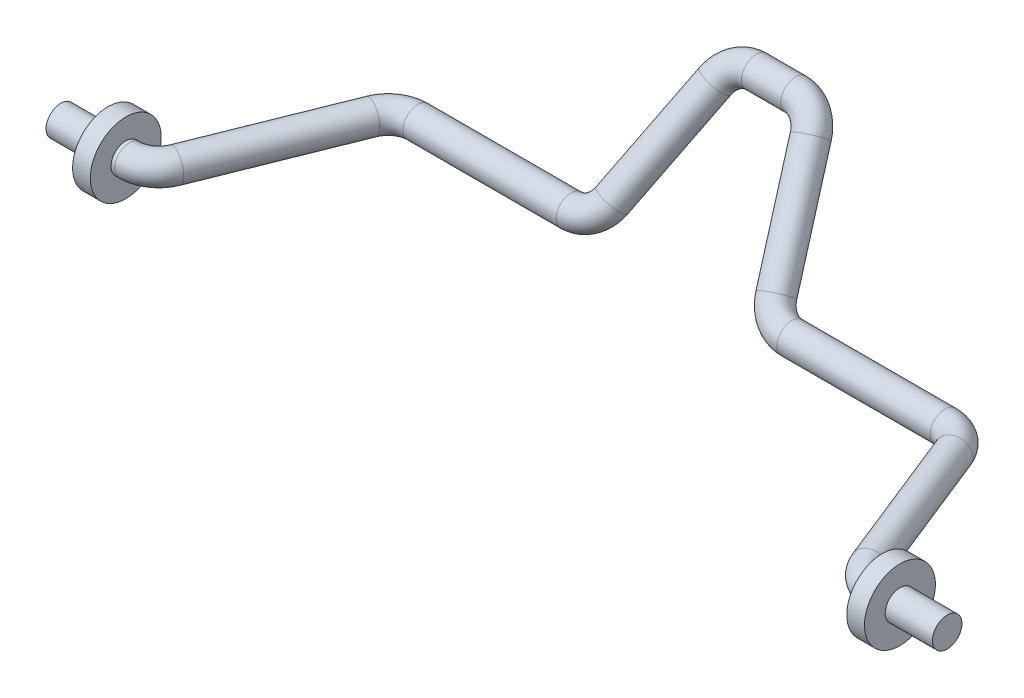
from build123d import *

# Parameters (mm, degrees)
SKETCH1_R           = 2.5
SKETCH3_R           = 6
BOSS_EXTRUDE1_DEPTH = 3


with BuildPart() as part:
    # Sweep1: sweep along a curve in space
    with BuildLine() as sweep1_path:
        Line((0, 20, -16), (-3.323510401, 20, -16))
        ThreePointArc((-3.323510401, 20, -16), (-6.285472594, 19.24118898, -15.392951184), (-8.096117422, 17.259706446, -13.807765157))
        Line((-13.903882578, 2.740293554, -2.192234843), (-8.096117422, 17.259706446, -13.807765157))
        ThreePointArc((-18.676489599, 0, 0), (-15.714527406, 0.75881102, -0.607048816), (-13.903882578, 2.740293554, -2.192234843))
        Line((-44.614835193, 0, 0), (-18.676489599, 0, 0))
        ThreePointArc((-49.257218647, 0, 3.143046618), (-47.417979239, 0, 0.859663848), (-44.614835193, 0, 0))
        Line((-58.742781353, 0, 26.856953382), (-49.257218647, 0, 3.143046618))
        ThreePointArc((-63.385164807, 0, 30), (-60.582020761, 0, 29.140336152), (-58.742781353, 0, 26.856953382))
        Line((-75, 0, 30), (-63.385164807, 0, 30))
    # Sketch1 → Sweep1 (sweep)
    with BuildSketch(Plane(origin=(0, 0, 0), x_dir=(0, 0, -1), z_dir=(1, 0, 0))):
        with Locations((16, 20)):
            Circle(SKETCH1_R)
    sweep(path=sweep1_path.line)

    # Sketch3 → Boss-Extrude1 (add)
    with BuildSketch(Plane.ZY.offset(67)):
        with Locations((30, 0)):
            Circle(SKETCH3_R)
    extrude(amount=-BOSS_EXTRUDE1_DEPTH)

    # Mirror1: part across plane


with BuildPart() as part_1:
    add(part.part)
    add(part.part.mirror(Plane(origin=(0, 20, -16), x_dir=(0, 0, 1), z_dir=(1, 0, 0))))


solid = part_1.part
